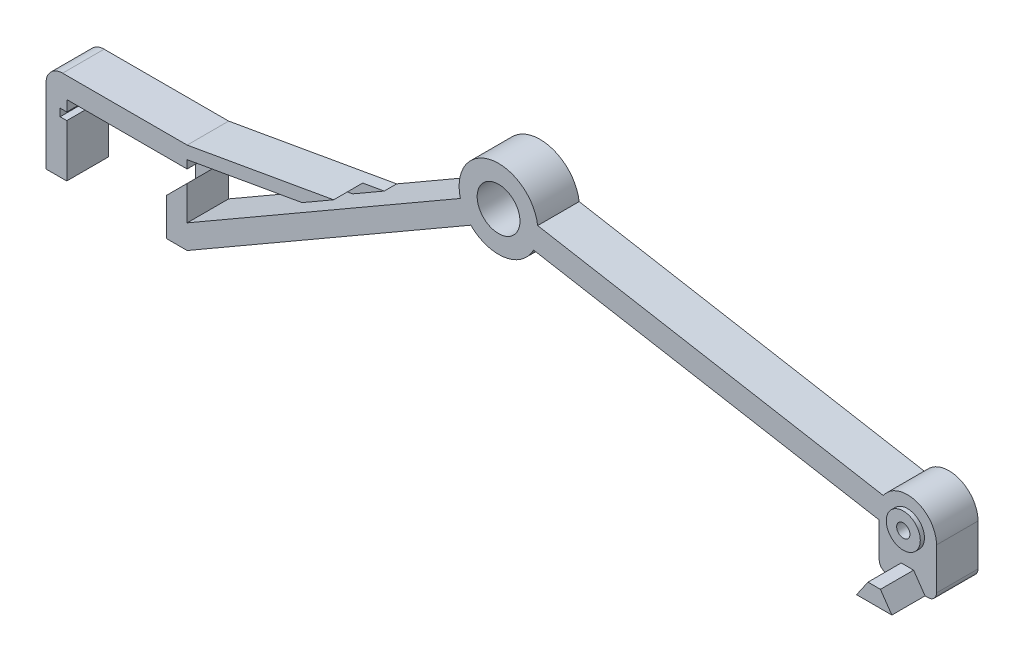
from build123d import *
from OCP.BRepFilletAPI import BRepFilletAPI_MakeFillet

# Parameters (mm, degrees)
SKETCH1_R           = 25.75
BOSS_EXTRUDE1_DEPTH = 25
SKETCH2_R           = 20.5
SKETCH2_R_2         = 8
BOSS_EXTRUDE2_DEPTH = 5
BOSS_EXTRUDE3_DEPTH = 50
SKETCH5_R           = 8
CUT_EXTRUDE1_DEPTH  = 1085.93491698
SKETCH6_R           = 17.5
CUT_EXTRUDE2_DEPTH  = 15
SKETCH7_W           = 8
SKETCH7_H           = 9
CUT_EXTRUDE3_DEPTH  = 35
BOSS_EXTRUDE4_DEPTH = 40
SKETCH9_R           = 6
CUT_EXTRUDE4_DEPTH  = 38.2
FILLET1_R1          = 20
FILLET1_R2          = 10


with BuildPart() as part:
    # Sketch1 → Boss-Extrude1 (new, symmetric)
    with BuildSketch(Plane.XY):
        with BuildLine():
            Line((0, 0), (-25, 0))
            Line((-25, 0), (-25, 110))
            Line((-25, 110), (145, 110))
            Line((145, 110), (145, 28.867513459))
            Line((145, 28.867513459), (474.063730334, 218.852546748))
            ThreePointArc((474.063730334, 218.852546748), (510.873444118, 277.555083571), (567.103024177, 237.06833037))
            Line((567.103024177, 237.06833037), (983.374527569, 163.668433022))
            ThreePointArc((983.374527569, 163.668433022), (1022.625735123, 177.590092488), (1047.403876506, 144.116018842))
            Line((1047.403876506, 144.116018842), (1047.403876506, 84.116018842))
            Line((1047.403876506, 84.116018842), (978.437892023, 84.116018842))
            Line((978.437892023, 84.116018842), (978.437892023, 135.671381603))
            Line((978.437892023, 135.671381603), (562.166388631, 209.071278951))
            ThreePointArc((562.166388631, 209.071278951), (527.367103522, 184.014892858), (486.563730334, 197.201911654))
            Line((486.563730334, 197.201911654), (145, 0))
            Line((145, 0), (120, 0))
            Line((120, 0), (120, 85))
            Line((120, 85), (0, 85))
            Line((0, 85), (0, 0))
        make_face()
        with Locations((520, 230.940107676)):
            Circle(SKETCH1_R, mode=Mode.SUBTRACT)
    extrude(amount=BOSS_EXTRUDE1_DEPTH, both=True)

    # Sketch2 → Boss-Extrude2 (add)
    with BuildSketch(Plane.XY.offset(25)):
        with Locations((1012.403876506, 144.116018842)):
            Circle(SKETCH2_R)
        with Locations((1012.403876506, 144.116018842)):
            Circle(SKETCH2_R_2, mode=Mode.SUBTRACT)
    extrude(amount=BOSS_EXTRUDE2_DEPTH)

    # Sketch4 → Boss-Extrude3 (add)
    with BuildSketch(Plane.XY.offset(25)):
        Polygon((145, 110), (347.313653274, 145.673355638), (309.33231998, 123.744822637), (145, 94.768600822), align=None)
    extrude(amount=-BOSS_EXTRUDE3_DEPTH)

    # Sketch5 → Cut-Extrude1 (cut, through all)
    with BuildSketch(Plane.XY.offset(25)):
        with Locations((1012.403876506, 144.116018842)):
            Circle(SKETCH5_R)
    extrude(amount=-CUT_EXTRUDE1_DEPTH, mode=Mode.SUBTRACT)

    # Sketch6 → Cut-Extrude2 (cut)
    with BuildSketch(Plane(origin=(0, 0, -25), x_dir=(-1, 0, 0), z_dir=(0, 0, -1))):
        with Locations((-1012.403876506, 144.116018842)):
            Circle(SKETCH6_R)
    extrude(amount=-CUT_EXTRUDE2_DEPTH, mode=Mode.SUBTRACT)

    # Sketch7 → Cut-Extrude3 (cut)
    with BuildSketch(Plane.XY.offset(25)):
        Polygon((120, 85), (145, 85), (145, 70), (120, 45), align=None)
        Polygon((347.313653274, 145.673355638), (309.33231998, 123.744822637), (283.417852806, 119.175402883), (321.3991861, 141.103935884), align=None)
        with Locations((-4, 67.5)):
            Rectangle(SKETCH7_W, SKETCH7_H)
    extrude(amount=-CUT_EXTRUDE3_DEPTH, mode=Mode.SUBTRACT)

    # Sketch8 → Boss-Extrude4 (add)
    with BuildSketch(Plane.XY.offset(25)):
        Polygon((991.153876506, 84.116018842), (1033.653876506, 84.116018842), (1019.903876506, 104.116018842), (1004.903876506, 104.116018842), align=None)
    extrude(amount=BOSS_EXTRUDE4_DEPTH)

    # Sketch9 → Cut-Extrude4 (cut)
    with BuildSketch(Plane.XZ):
        with Locations((-7.475, 0)):
            Circle(SKETCH9_R)
        with Locations((127.475, 0)):
            Circle(SKETCH9_R)
    extrude(amount=-CUT_EXTRUDE4_DEPTH, mode=Mode.SUBTRACT)

    # Fillet1: one fillet with a radius per group of edges: ONE call of the kernel's fillet builder (fillet() takes one radius for all edges)
    fillet1_edges_1 = [part.edges().sort_by_distance(p)[0] for p in [
        (-25, 110, 0),
    ]]
    fillet1_edges_2 = [part.edges().sort_by_distance(p)[0] for p in [
        (1047.403876506, 84.116018842, 0),
        (978.437892023, 84.116018842, 0),
    ]]
    fillet1 = BRepFilletAPI_MakeFillet(part.part.solid().wrapped)
    for e in fillet1_edges_1:
        fillet1.Add(FILLET1_R1, e.wrapped)
    for e in fillet1_edges_2:
        fillet1.Add(FILLET1_R2, e.wrapped)
    add(Compound.cast(fillet1.Shape()), mode=Mode.REPLACE)


solid = part.part
